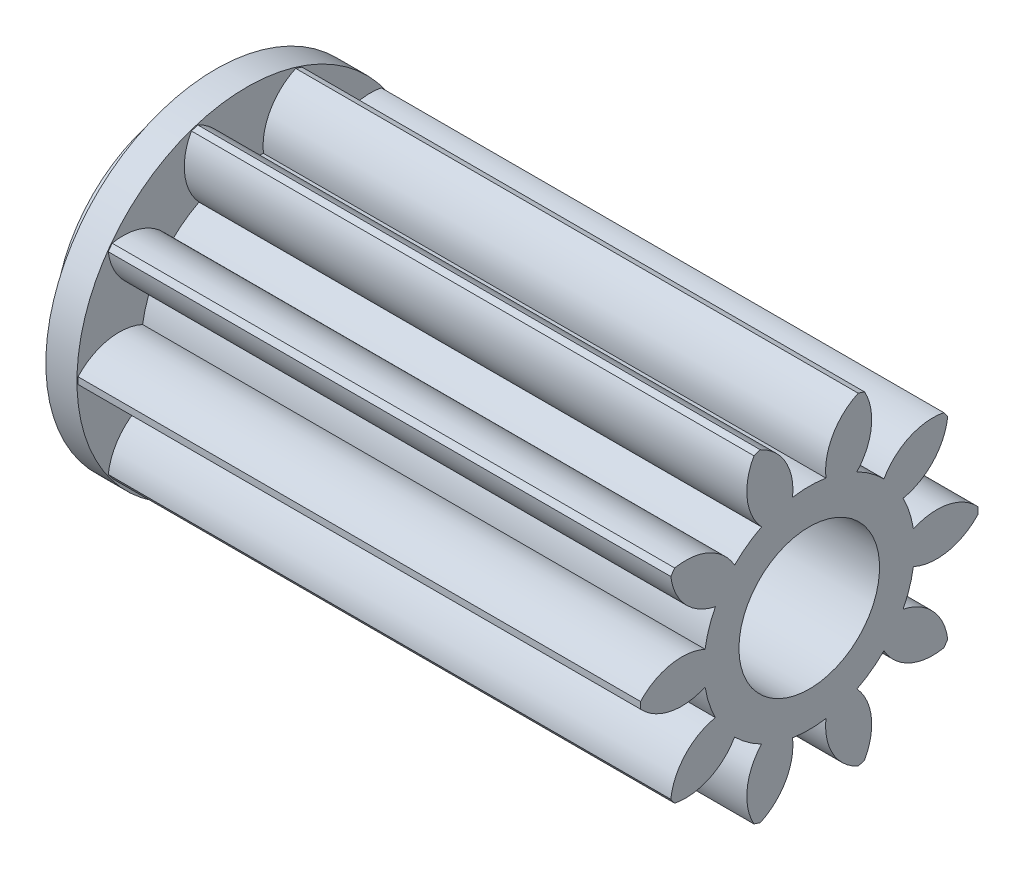
from build123d import *

# Parameters (mm, degrees)
BASPROSKE_W     = 20
BASPROSKE_H     = 6
TOOTHCUT_DEPTH  = 22.725560982
TEETHCUTS_COUNT = 10
TEETHCUTS_ANGLE = 324
BORSKE_R        = 2.5
BORE_DEPTH      = 50.0000508
SCALE_1_SCALE   = 1.085


with BuildPart() as part:
    # BasProSke → Base-Revolve (revolve)
    with BuildSketch(Plane(origin=(0, 0, 0), x_dir=(1, 0, 0), z_dir=(0, 1, 0)), mode=Mode.PRIVATE) as base_revolve_sk:
        with Locations((10, 3)):
            Rectangle(BASPROSKE_W, BASPROSKE_H)
    revolve(base_revolve_sk.sketch.rotate(Axis((-10, 0, 0), (1, 0, 0)), 180), axis=Axis((-10, 0, 0), (1, 0, 0)))

    # TooCutSke → ToothCut (cut, through all)
    with BuildSketch(Plane(origin=(0, 0, 0), x_dir=(0, 0, -1), z_dir=(1, 0, 0))):
        with BuildLine():
            ThreePointArc((0.59278292, 3.701838653), (0, 3.749), (-0.59278292, 3.701838653))
            ThreePointArc((-0.59278292, 3.701838653), (-0.846593509, 4.924114224), (-1.775771316, 5.757784417))
            ThreePointArc((-1.775771316, 5.757784417), (0, 6.0254), (1.775771316, 5.757784417))
            ThreePointArc((1.775771316, 5.757784417), (0.846593509, 4.924114224), (0.59278292, 3.701838653))
        make_face()
    toothcut = extrude(amount=TOOTHCUT_DEPTH, mode=Mode.SUBTRACT)

    # TeethCuts: ToothCut ×10 about axis
    teethcuts_axis = Axis((-10, 0, 0), (1, 0, 0))
    for i in range(1, TEETHCUTS_COUNT):
        add(toothcut.rotate(teethcuts_axis, i * TEETHCUTS_ANGLE / (TEETHCUTS_COUNT - 1)), mode=Mode.SUBTRACT)

    # BorSke → Bore (cut, symmetric)
    with BuildSketch(Plane(origin=(0, 0, 0), x_dir=(0, 0, -1), z_dir=(1, 0, 0))):
        with Locations(Location((0, 0, 0), (0, 0, 180))):
            Circle(BORSKE_R)
    extrude(amount=BORE_DEPTH, both=True, mode=Mode.SUBTRACT)


with BuildPart() as part_1:
    # Масштаб1: scaled about (10, 0, 0)
    add(part.part.scale(SCALE_1_SCALE).moved(Location((-0.85, 0, 0))))

    # Эскиз2 → Повернуть1 (revolve)
    with BuildSketch(Plane(origin=(0, 0, 0), x_dir=(1, 0, 0), z_dir=(0, 1, 0))):
        Polygon((-0.85, 3.5), (-0.85, 6.55), (-2.05, 6.55), (-2.05, 5), (-3.25, 5), (-3.25, 3.924264069), (-2.825735931, 3.5), align=None)
    revolve(axis=Axis((0, 0, 0), (-1, 0, 0)))


solid = part_1.part
